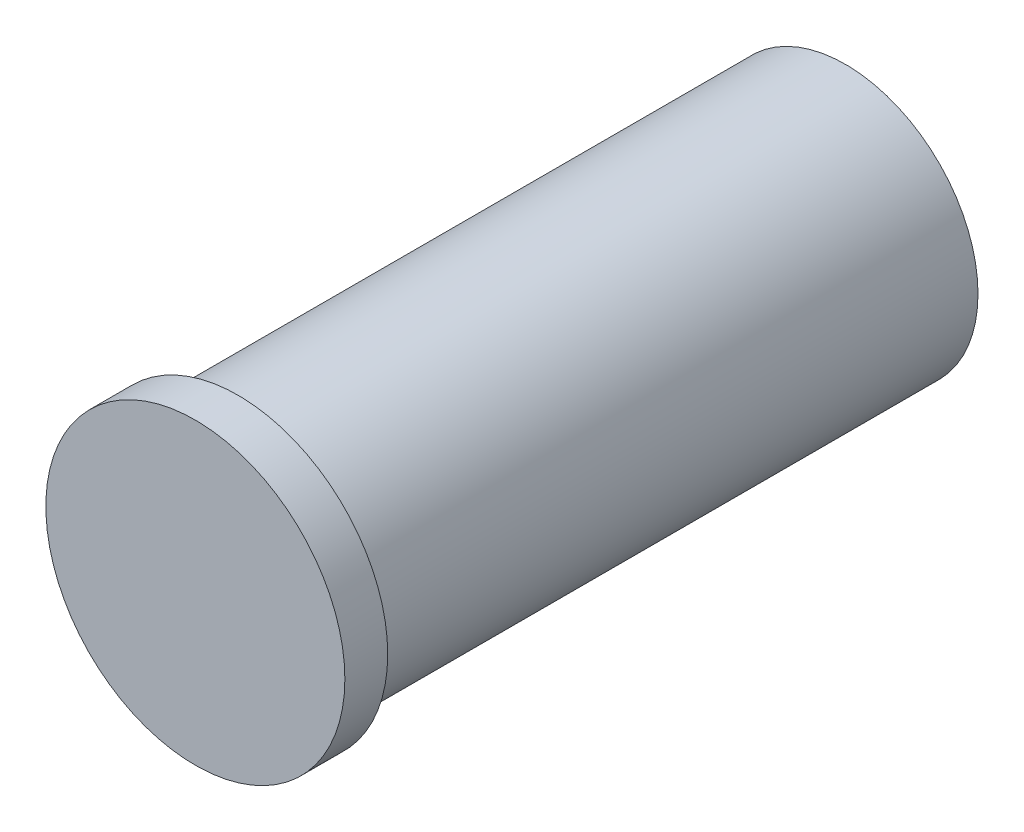
from build123d import *

# Parameters (mm, degrees)
SKETCH1_R           = 3.925
BOSS_EXTRUDE1_DEPTH = 18
SKETCH2_R           = 4.431145186
BOSS_EXTRUDE2_DEPTH = 1.27


with BuildPart() as part:
    # Sketch1 → Boss-Extrude1 (new body)
    with BuildSketch(Plane.XY):
        Circle(SKETCH1_R)
    extrude(amount=BOSS_EXTRUDE1_DEPTH)

    # Sketch2 → Boss-Extrude2 (add)
    with BuildSketch(Plane.XY.offset(18)):
        Circle(SKETCH2_R)
    extrude(amount=BOSS_EXTRUDE2_DEPTH)


solid = part.part
